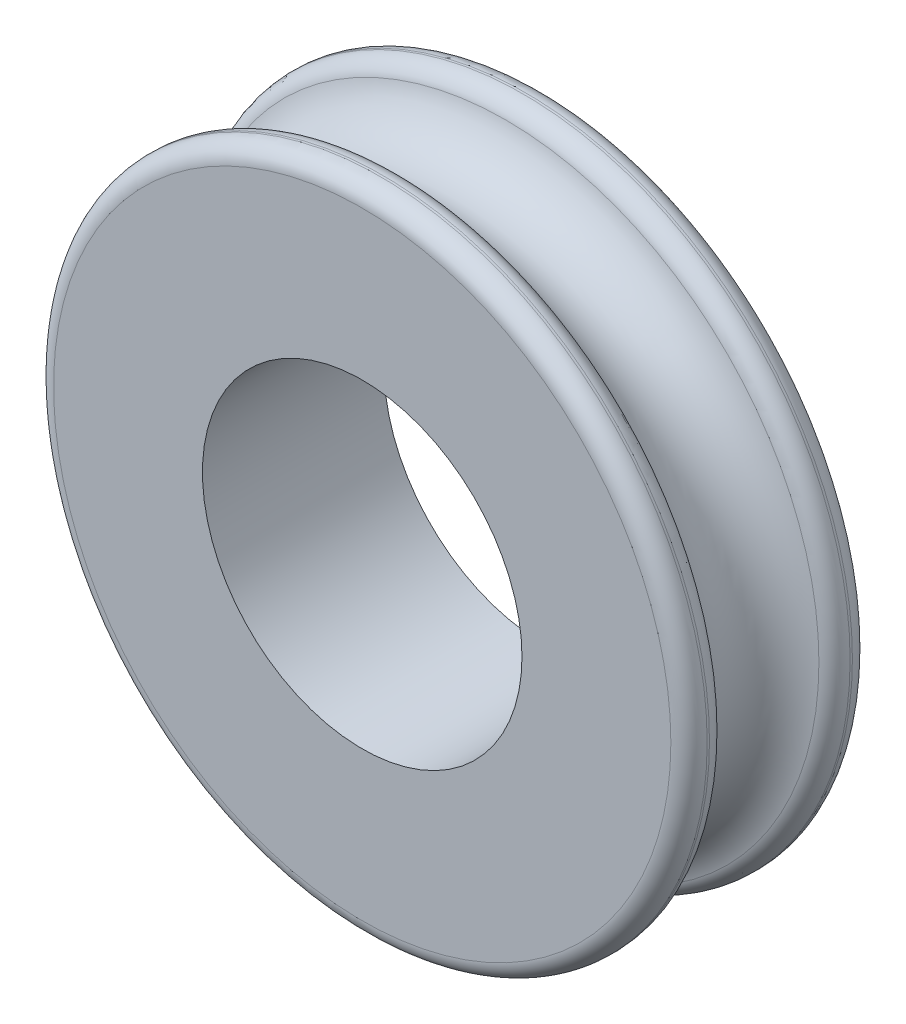
from build123d import *

# Parameters (mm, degrees)
SKETCH_1_R      = 9
SKETCH_1_R_2    = 4.4
EXTRUDE_1_DEPTH = 2.5
SKETCH_3_R      = 1.5
FILLET_1_R      = 0.5
FILLET_2_R      = 0.5


with BuildPart() as part:
    # Эскиз1 → Бобышка-Вытянуть1 (new, symmetric)
    with BuildSketch(Plane.XY):
        Circle(SKETCH_1_R)
        Circle(SKETCH_1_R_2, mode=Mode.SUBTRACT)
    extrude(amount=EXTRUDE_1_DEPTH, both=True)

    # Вырез-По траектории1: sweep along a path in Эскиз4
    with BuildLine(Plane.XY) as sweep_1_path:
        CenterArc((0, 0), 9, 0, 360)
    # Эскиз3 → Вырез-По траектории1 (sweep, cut)
    with BuildSketch(Plane(origin=(0, 0, 0), x_dir=(1, 0, 0), z_dir=(0, 1, 0))):
        with Locations((9, 0)):
            Circle(SKETCH_3_R)
    sweep(path=sweep_1_path.line, mode=Mode.SUBTRACT)

    # Скругление1
    fillet_1_edges = [part.edges().sort_by_distance(p)[0] for p in [
        (-9, 0, -2.5),
        (-9, 0, 2.5),
    ]]
    fillet(fillet_1_edges, radius=FILLET_1_R)

    # Скругление2
    fillet_2_edges = [part.edges().sort_by_distance(p)[0] for p in [
        (-9, 0, 1.5),
        (-9, 0, -1.5),
    ]]
    fillet(fillet_2_edges, radius=FILLET_2_R)


solid = part.part
